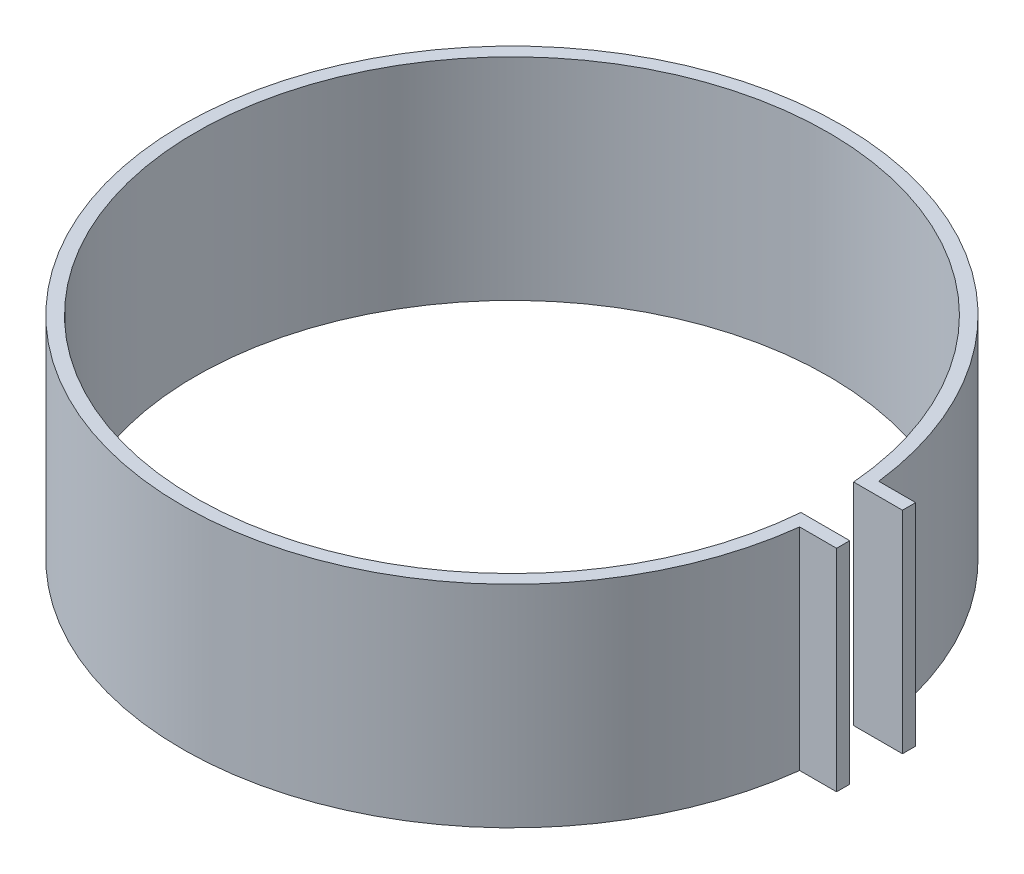
from build123d import *

# Parameters (mm, degrees)
BOSS_EXTRUDE1_DEPTH = 50.8


with BuildPart() as part:
    # Sketch2 → Boss-Extrude1 (new body)
    with BuildSketch(Plane(origin=(0, 0, 0), x_dir=(1, 0, 0), z_dir=(0, 1, 0))):
        with BuildLine():
            Line((78.800950314, -6.35), (87.690950314, -6.35))
            Line((87.690950314, -6.35), (87.690950314, -9.525))
            Line((87.690950314, -9.525), (78.801427652, -9.525))
            ThreePointArc((78.801427652, -9.525), (-79.375, 0), (78.801427652, 9.525))
            Line((78.801427652, 9.525), (87.690950314, 9.525))
            Line((87.690950314, 9.525), (87.690950314, 6.35))
            Line((87.690950314, 6.35), (78.800950314, 6.35))
            Line((78.800950314, 6.35), (75.934955719, 6.35))
            ThreePointArc((75.934955719, 6.35), (-76.2, 0), (75.934955719, -6.35))
            Line((75.934955719, -6.35), (78.800950314, -6.35))
        make_face()
    extrude(amount=BOSS_EXTRUDE1_DEPTH)


solid = part.part
